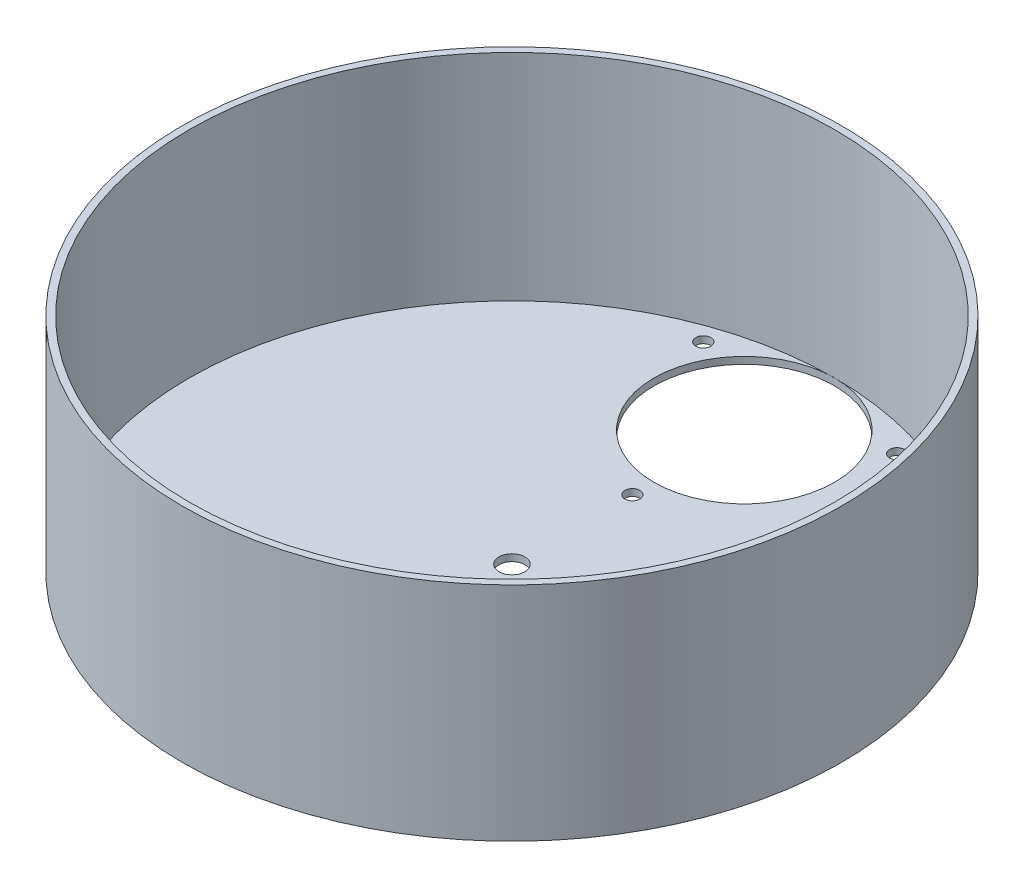
from build123d import *

# Parameters (mm, degrees)
SKETCH1_R           = 75
BOSS_EXTRUDE1_DEPTH = 50
SHELL1_T            = 1.6
SKETCH2_R           = 21
CUT_EXTRUDE1_DEPTH  = 50
SKETCH3_R           = 1.75
CUT_EXTRUDE2_DEPTH  = 50
SKETCH4_R           = 3
CUT_EXTRUDE3_DEPTH  = 50


with BuildPart() as part:
    # Sketch1 → Boss-Extrude1 (new body)
    with BuildSketch(Plane(origin=(0, 0, 0), x_dir=(1, 0, 0), z_dir=(0, 1, 0))):
        with Locations(Location((0, 0, 0), (0, 0, 270))):
            Circle(SKETCH1_R)
    extrude(amount=BOSS_EXTRUDE1_DEPTH)

    # Shell1
    shell1_openings = [part.faces().sort_by_distance(p)[0] for p in [
        (0, 50, 0),
    ]]
    offset(amount=SHELL1_T, openings=shell1_openings, kind=Kind.INTERSECTION)

    # Sketch2 → Cut-Extrude1 (cut)
    with BuildSketch(Plane(origin=(0, 0, 0), x_dir=(1, 0, 0), z_dir=(0, 1, 0))):
        with Locations(Location((0, 54, 0), (0, 0, 270))):
            Circle(SKETCH2_R)
    extrude(amount=-CUT_EXTRUDE1_DEPTH, mode=Mode.SUBTRACT)

    # Sketch3 → Cut-Extrude2 (cut)
    with BuildSketch(Plane(origin=(0, 0, 0), x_dir=(1, 0, 0), z_dir=(0, 1, 0))):
        with Locations(Location((0, 28, 0), (0, 0, 270))):
            Circle(SKETCH3_R)
        with Locations(Location((-22.516660498, 67, 0), (0, 0, 270))):
            Circle(SKETCH3_R)
        with Locations(Location((22.516660498, 67, 0), (0, 0, 270))):
            Circle(SKETCH3_R)
    extrude(amount=-CUT_EXTRUDE2_DEPTH, mode=Mode.SUBTRACT)

    # Sketch4 → Cut-Extrude3 (cut)
    with BuildSketch(Plane(origin=(0, 0, 0), x_dir=(1, 0, 0), z_dir=(0, 1, 0))):
        with Locations(Location((0, 0, 0), (0, 0, 270))):
            Circle(SKETCH4_R)
    extrude(amount=-CUT_EXTRUDE3_DEPTH, mode=Mode.SUBTRACT)


solid = part.part
